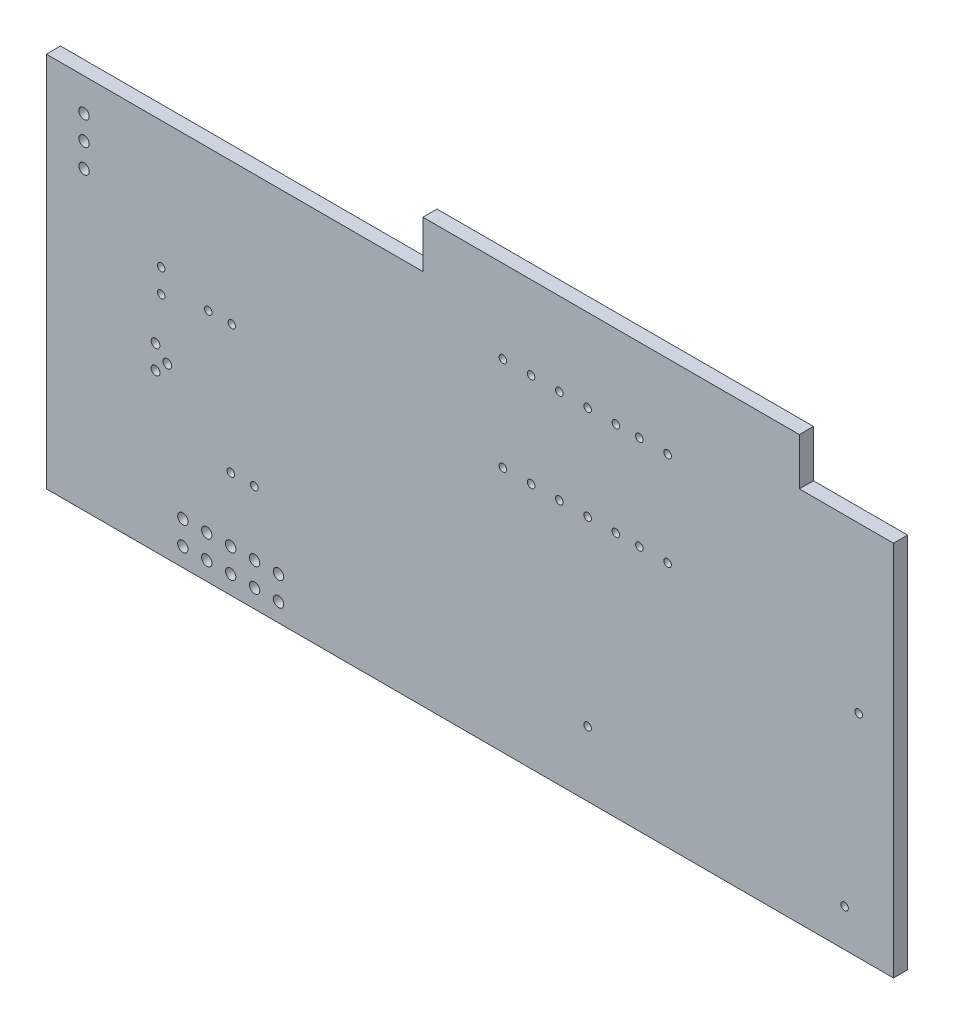
from build123d import *

# Parameters (mm, degrees)
EXTRUDE_1_DEPTH     = 1.5
SKETCH_2_R          = 0.55
CUT_EXTRUDE_1_DEPTH = 1.5
SKETCH_3_R          = 0.4
CUT_EXTRUDE_2_DEPTH = 10
SKETCH_6_R          = 0.465027249
SKETCH_6_R_2        = 0.4
CUT_EXTRUDE_4_DEPTH = 10


with BuildPart() as part:
    # Эскиз1 → Вытянуть1 (new body)
    with BuildSketch(Plane.XY):
        Polygon((0, 20), (0, 25), (40, 25), (40, 20), (50, 20), (50, -20), (-40, -20), (-40, 20), align=None)
    extrude(amount=EXTRUDE_1_DEPTH)

    # Эскиз2 → Вырез-Вытянуть1 (cut)
    with BuildSketch(Plane.XY.offset(1.5)):
        with Locations((-36, 16.54)):
            Circle(SKETCH_2_R)
        with Locations((-36, 11.46)):
            Circle(SKETCH_2_R)
        with Locations((-36, 14)):
            Circle(SKETCH_2_R)
        with Locations((-25.5, -15.5)):
            Circle(SKETCH_2_R)
        with Locations((-25.5, -18.04)):
            Circle(SKETCH_2_R)
        with Locations((-22.96, -15.5)):
            Circle(SKETCH_2_R)
        with Locations((-22.96, -18.04)):
            Circle(SKETCH_2_R)
        with Locations((-20.42, -15.5)):
            Circle(SKETCH_2_R)
        with Locations((-20.42, -18.04)):
            Circle(SKETCH_2_R)
        with Locations((-17.88, -15.5)):
            Circle(SKETCH_2_R)
        with Locations((-17.88, -18.04)):
            Circle(SKETCH_2_R)
        with Locations((-15.34, -15.5)):
            Circle(SKETCH_2_R)
        with Locations((-15.34, -18.04)):
            Circle(SKETCH_2_R)
    extrude(amount=-CUT_EXTRUDE_1_DEPTH, mode=Mode.SUBTRACT)

    # Эскиз3 → Вырез-Вытянуть2 (cut)
    with BuildSketch(Plane.XY.offset(1.5)):
        with Locations((-17.902737838, -8.7)):
            Circle(SKETCH_3_R)
        with Locations((-20.3, 5)):
            Circle(SKETCH_3_R)
        with Locations((8.5, 16.2)):
            Circle(SKETCH_3_R)
        with Locations((8.5, 6.2)):
            Circle(SKETCH_3_R)
        with Locations((11.5, 16.2)):
            Circle(SKETCH_3_R)
        with Locations((11.5, 6.2)):
            Circle(SKETCH_3_R)
        with Locations((14.5, 16.2)):
            Circle(SKETCH_3_R)
        with Locations((14.5, 6.2)):
            Circle(SKETCH_3_R)
        with Locations((17.5, 16.2)):
            Circle(SKETCH_3_R)
        with Locations((17.5, 6.2)):
            Circle(SKETCH_3_R)
        with Locations((20.5, 16.2)):
            Circle(SKETCH_3_R)
        with Locations((20.5, 6.2)):
            Circle(SKETCH_3_R)
        with Locations((23, 16.2)):
            Circle(SKETCH_3_R)
        with Locations((23, 6.2)):
            Circle(SKETCH_3_R)
        with Locations((26, 16.2)):
            Circle(SKETCH_3_R)
        with Locations((26, 6.2)):
            Circle(SKETCH_3_R)
        with Locations((-20.402737838, -8.7)):
            Circle(SKETCH_3_R)
        with Locations((-22.8, 5)):
            Circle(SKETCH_3_R)
        with Locations((-27.8, 6.5)):
            Circle(SKETCH_3_R)
        with Locations((-27.8, 4)):
            Circle(SKETCH_3_R)
    extrude(amount=-CUT_EXTRUDE_2_DEPTH, mode=Mode.SUBTRACT)

    # Эскиз6 → Вырез-Вытянуть4 (cut)
    with BuildSketch(Plane.XY.offset(1.5)):
        with Locations((-28.4, -3.3)):
            Circle(SKETCH_6_R)
        with Locations((-28.4, -0.8)):
            Circle(SKETCH_6_R)
        with Locations((-27.15, -2.05)):
            Circle(SKETCH_6_R)
        with Locations((46.3, 2.5)):
            Circle(SKETCH_6_R_2)
        with Locations((17.5, -13.1)):
            Circle(SKETCH_6_R_2)
        with Locations((44.8, -16)):
            Circle(SKETCH_6_R_2)
    extrude(amount=-CUT_EXTRUDE_4_DEPTH, mode=Mode.SUBTRACT)


solid = part.part
